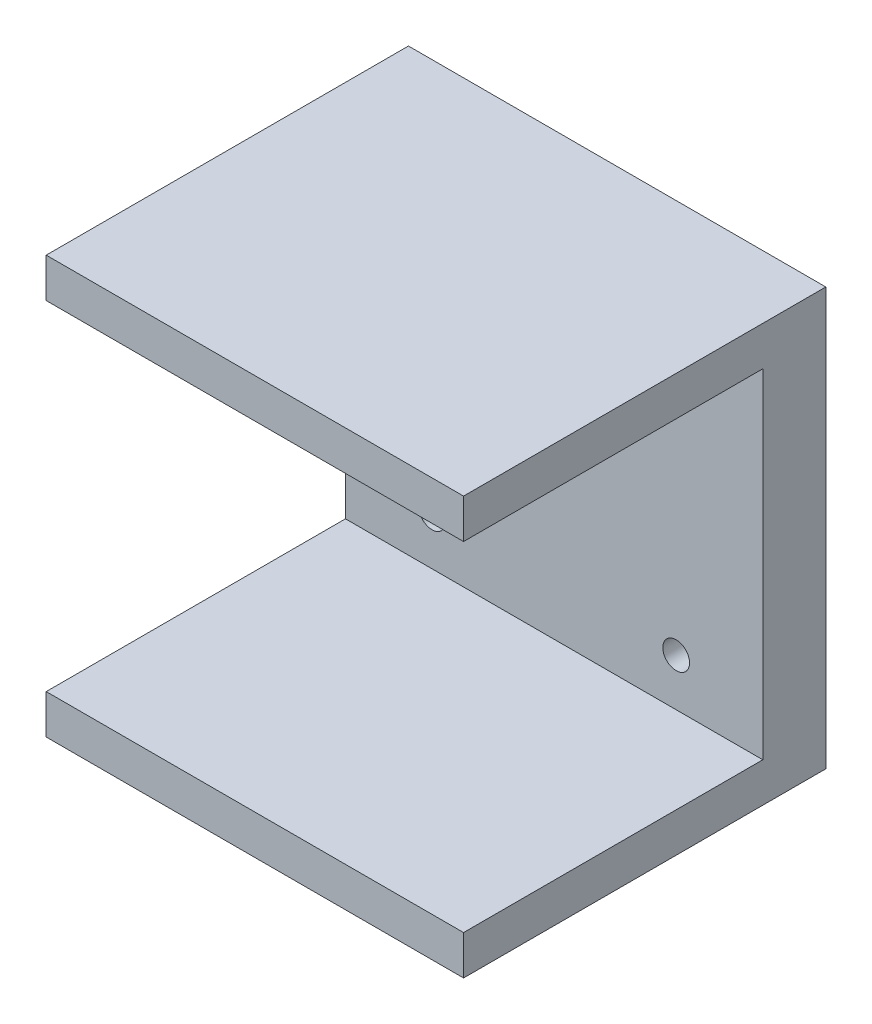
from build123d import *

# Parameters (mm, degrees)
SKETCH1_W           = 53
SKETCH1_H           = 43
BOSS_EXTRUDE1_DEPTH = 5
SKETCH2_W           = 53
SKETCH2_H           = 5
BOSS_EXTRUDE2_DEPTH = 43
SKETCH4_R           = 1.7
CUT_EXTRUDE1_DEPTH  = 58.039460025
SKETCH6_W           = 53
SKETCH6_H           = 53
SKETCH6_R           = 2.95
BOSS_EXTRUDE5_DEPTH = 3


with BuildPart() as part:
    # Sketch1 → Boss-Extrude1 (new body)
    with BuildSketch(Plane.XY):
        Rectangle(SKETCH1_W, SKETCH1_H)
    extrude(amount=BOSS_EXTRUDE1_DEPTH)

    # Sketch2 → Boss-Extrude2 (add)
    with BuildSketch(Plane(origin=(0, 0, 0), x_dir=(-1, 0, 0), z_dir=(0, 0, -1))):
        with Locations((0, -24)):
            Rectangle(SKETCH2_W, SKETCH2_H)
        with Locations((0, 24)):
            Rectangle(SKETCH2_W, SKETCH2_H)
    extrude(amount=-BOSS_EXTRUDE2_DEPTH)

    # Sketch4 → Cut-Extrude1 (cut, through all)
    with BuildSketch(Plane(origin=(0, 0, 0), x_dir=(-1, 0, 0), z_dir=(0, 0, -1))):
        with Locations((-15.5, 15.5)):
            Circle(SKETCH4_R)
        with Locations((15.5, 15.5)):
            Circle(SKETCH4_R)
        with Locations((-15.5, -15.5)):
            Circle(SKETCH4_R)
        with Locations((15.5, -15.5)):
            Circle(SKETCH4_R)
    extrude(amount=-CUT_EXTRUDE1_DEPTH, mode=Mode.SUBTRACT)

    # Sketch6 → Boss-Extrude5 (add)
    with BuildSketch(Plane.XY):
        Rectangle(SKETCH6_W, SKETCH6_H)
        with Locations((-15.5, 15.5)):
            Circle(SKETCH6_R, mode=Mode.SUBTRACT)
        with Locations(Location((15.5, 15.5, 0), (0, 0, 180))):
            Circle(SKETCH6_R, mode=Mode.SUBTRACT)
        with Locations(Location((-15.5, -15.5, 0), (0, 0, 180))):
            Circle(SKETCH6_R, mode=Mode.SUBTRACT)
        with Locations(Location((15.5, -15.5, 0), (0, 0, 180))):
            Circle(SKETCH6_R, mode=Mode.SUBTRACT)
    extrude(amount=-BOSS_EXTRUDE5_DEPTH)


solid = part.part
